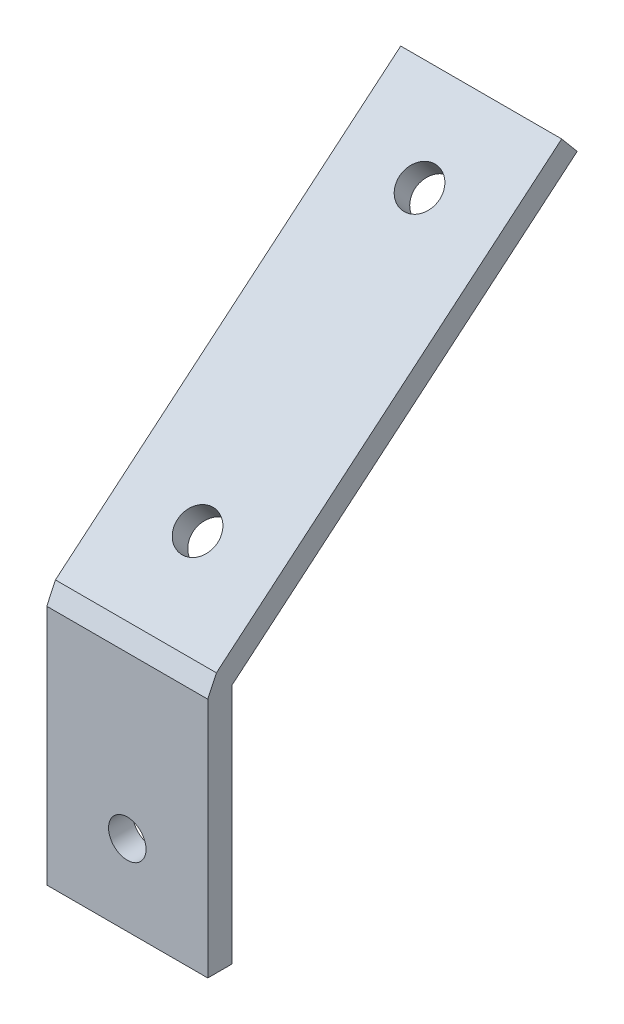
from build123d import *

# Parameters (mm, degrees)
EXTRUDE_1_DEPTH     = 20
CUT_EXTRUDE_1_REACH = 83.569
SKETCH_3_R          = 2.5
SKETCH_4_R          = 2.328749205
CUT_EXTRUDE_2_DEPTH = 100


with BuildPart() as part:
    # 草图2 → 凸台-拉伸1 (new body)
    with BuildSketch(Plane(origin=(0, 0, 0), x_dir=(0, 0, -1), z_dir=(1, 0, 0))):
        Polygon((1.071637171, 32.298133329), (0, 30), (0, 0), (3, 0), (3, 30), (45.898488815, 65.996106142), (43.970125986, 68.294239472), align=None)
    extrude(amount=EXTRUDE_1_DEPTH)

    # 草图3 → 切除-拉伸1 (cut, up to next)
    with BuildSketch(Plane(origin=(0, 16.127511035, 13.532588562), x_dir=(-1, 0, 0), z_dir=(0, -0.7660444431189622, -0.6427876096865582)), mode=Mode.PRIVATE) as cut_extrude_1_sk1:
        with Locations((-10, 67.58176162)):
            Circle(SKETCH_3_R)
    cut_extrude_1_tool1 = extrude(cut_extrude_1_sk1.sketch, amount=-CUT_EXTRUDE_1_REACH, mode=Mode.PRIVATE) & part.part
    # 草图3 → 切除-拉伸1 (cut, up to next)
    with BuildSketch(Plane(origin=(0, 16.127511035, 13.532588562), x_dir=(-1, 0, 0), z_dir=(0, -0.7660444431189622, -0.6427876096865582)), mode=Mode.PRIVATE) as cut_extrude_1_sk2:
        with Locations((-10, 31.58176162)):
            Circle(SKETCH_3_R)
    cut_extrude_1_tool2 = extrude(cut_extrude_1_sk2.sketch, amount=-CUT_EXTRUDE_1_REACH, mode=Mode.PRIVATE) & part.part
    add(cut_extrude_1_tool1.solids().sort_by_distance((10, 59.56823, -38.238044))[0], mode=Mode.SUBTRACT)
    add(cut_extrude_1_tool2.solids().sort_by_distance((10, 36.427876, -10.660444))[0], mode=Mode.SUBTRACT)

    # 草图4 → 切除-拉伸2 (cut)
    with BuildSketch(Plane(origin=(0, 0, -3), x_dir=(-1, 0, 0), z_dir=(0, 0, -1))):
        with Locations((-10, 10)):
            Circle(SKETCH_4_R)
    extrude(amount=-CUT_EXTRUDE_2_DEPTH, mode=Mode.SUBTRACT)


solid = part.part
